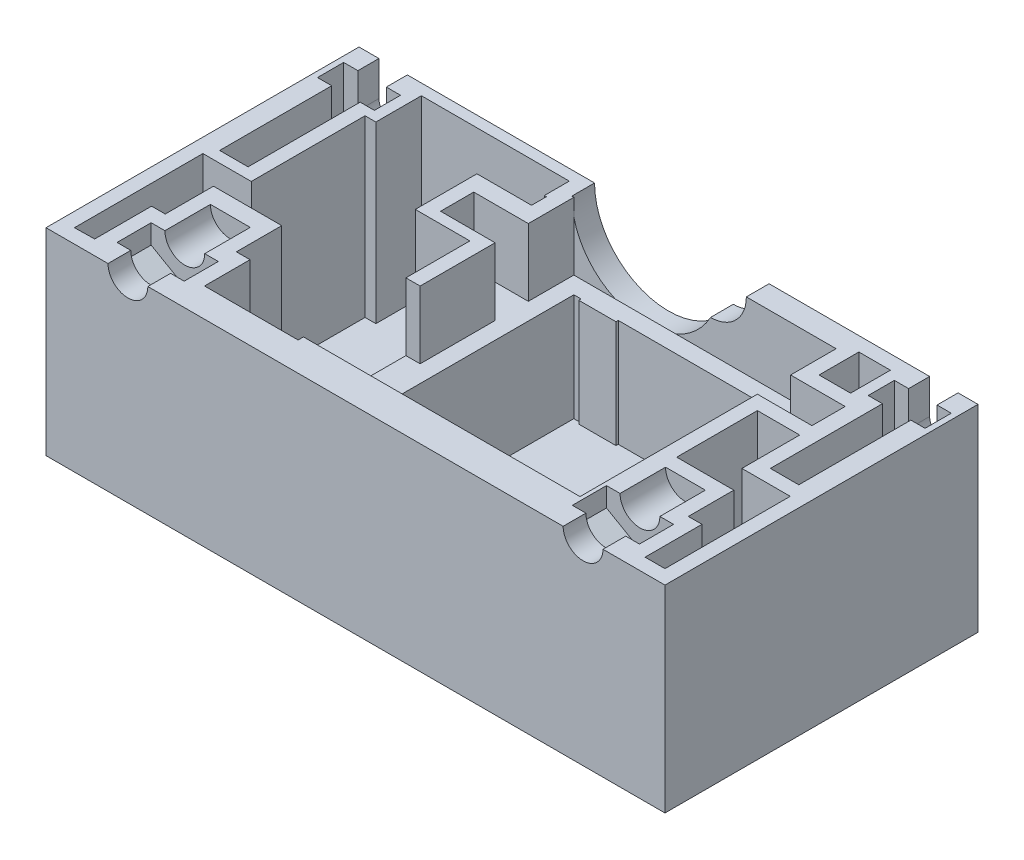
from build123d import *

# Parameters (mm, degrees)
SKETCH1_W           = 54.3999928
SKETCH1_H           = 27.5100034
BOSS_EXTRUDE1_DEPTH = 17.3500034
CUT_EXTRUDE1_DEPTH  = 15.3500074
CUT_EXTRUDE2_DEPTH  = 5.9200034
CUT_EXTRUDE3_DEPTH  = 9.430004
SKETCH5_W           = 4.795012
SKETCH5_H           = 2.9200094
CUT_EXTRUDE4_DEPTH  = 5.9200034
SKETCH6_W           = 2.769997
SKETCH6_H           = 3.499993
CUT_EXTRUDE5_DEPTH  = 15.3500074
CUT_EXTRUDE6_DEPTH  = 15.3500074
SKETCH8_R           = 1.7499965
CUT_EXTRUDE7_DEPTH  = 9.0000074
CUT_EXTRUDE8_DEPTH  = 13.9999974
SKETCH10_W          = 4.99999
SKETCH10_H          = 2.2999954
CUT_EXTRUDE9_DEPTH  = 4.320159
CUT_EXTRUDE10_DEPTH = 1.999996
CUT_EXTRUDE11_DEPTH = 2.999994
CUT_EXTRUDE12_DEPTH = 1.999996


with BuildPart() as part:
    # Sketch1 → Boss-Extrude1 (new body)
    with BuildSketch(Plane(origin=(0, 0, 0), x_dir=(1, 0, 0), z_dir=(0, 1, 0))):
        Rectangle(SKETCH1_W, SKETCH1_H)
    extrude(amount=BOSS_EXTRUDE1_DEPTH)

    # Sketch2 → Cut-Extrude1 (cut)
    with BuildSketch(Plane(origin=(0, 17.3500034, 0), x_dir=(1, 0, 0), z_dir=(0, 1, 0))):
        Polygon((-7.7499972, 12.7852805), (-20.7499966, 12.7852805), (-20.7499712, 8.7852885), (-21.699982, 8.7852885), (-21.699982, -1.2147169), (-25.9499862, -1.2147169), (-25.9499862, -12.5049915), (-24.199309728, -12.476075327), (-24.199309728, -7.476085327), (-22.999312128, -7.476085327), (-22.999312128, -3.2369379), (-16.999324128, -3.2369379), (-16.999324128, -7.2247379), (-15.799326528, -7.2247379), (-15.799326528, -11.2247299), (-7.569320128, -11.2247299), (-7.569320128, 3.8652831), (-12.364974, 3.8652831), (-12.364974, 9.2852875), (-7.5699874, 9.2852875), (-7.5699874, 10.5852849), (-7.7499972, 10.5852849), align=None)
    extrude(amount=-CUT_EXTRUDE1_DEPTH, mode=Mode.SUBTRACT)

    # Sketch3 → Cut-Extrude2 (cut)
    with BuildSketch(Plane(origin=(0, 17.3500034, 0), x_dir=(1, 0, 0), z_dir=(0, 1, 0))):
        Polygon((-7.5699874, -10.7550077), (-7.5699874, -1.7550003), (-6.3199772, -1.7550003), (-6.3199772, 11.7550057), (16.7300148, 11.7550057), (16.7300148, -10.7550077), align=None)
    extrude(amount=-CUT_EXTRUDE2_DEPTH, mode=Mode.SUBTRACT)

    # Sketch4 → Cut-Extrude3 (cut)
    with BuildSketch(Plane(origin=(0, 11.43, 0), x_dir=(1, 0, 0), z_dir=(0, 1, 0))):
        Polygon((15.2300178, 10.2550087), (15.2300178, -9.2549853), (-4.8199802, -9.2549853), (-4.8199802, 10.2550087), (-4.1839388, 10.2550087), (-4.1839388, 10.0550091), (-0.916671965, 10.0550091), (-0.916671965, 10.2550087), align=None)
    extrude(amount=-CUT_EXTRUDE3_DEPTH, mode=Mode.SUBTRACT)

    # Sketch5 → Cut-Extrude4 (cut)
    with BuildSketch(Plane(origin=(0, 17.3500034, 0), x_dir=(1, 0, 0), z_dir=(0, 1, 0))):
        with Locations((-8.7174832, 6.2949836)):
            Rectangle(SKETCH5_W, SKETCH5_H)
        with Locations((19.1275208, 6.2949836)):
            Rectangle(SKETCH5_W, SKETCH5_H)
    extrude(amount=-CUT_EXTRUDE4_DEPTH, mode=Mode.SUBTRACT)

    # Sketch6 → Cut-Extrude5 (cut)
    with BuildSketch(Plane(origin=(0, 17.3500034, 0), x_dir=(1, 0, 0), z_dir=(0, 1, 0))):
        with Locations((19.3649981, 10.754995)):
            Rectangle(SKETCH6_W, SKETCH6_H)
    extrude(amount=-CUT_EXTRUDE5_DEPTH, mode=Mode.SUBTRACT)

    # Sketch7 → Cut-Extrude6 (cut)
    with BuildSketch(Plane(origin=(0, 17.3500034, 0), x_dir=(1, 0, 0), z_dir=(0, 1, 0))):
        Polygon((21.7000074, 3.5849941), (17.9799996, 3.5849941), (17.9799996, -3.5050095), (23.0000048, -3.5050095), (23.0000048, -7.5050015), (24.2000024, -7.5050015), (24.2000024, -12.5049915), (25.9500116, -12.5049915), (25.9500116, -1.4949805), (21.7000074, -1.4949805), align=None)
    extrude(amount=-CUT_EXTRUDE6_DEPTH, mode=Mode.SUBTRACT)

    # Sketch8 → Cut-Extrude7 (cut)
    with BuildSketch(Plane.XY.offset(13.7550017)):
        with Locations((-19.9999981, 17.3500034)):
            Circle(SKETCH8_R)
        with Locations((19.9999981, 17.3500034)):
            Circle(SKETCH8_R)
    extrude(amount=-CUT_EXTRUDE7_DEPTH, mode=Mode.SUBTRACT)

    # Sketch9 → Cut-Extrude8 (cut)
    with BuildSketch(Plane(origin=(0, 0, -13.7550017), x_dir=(-1, 0, 0), z_dir=(0, 0, -1))):
        with BuildLine():
            Line((-25.4499872, 17.3500034), (-25.4499872, 14.2999968))
            ThreePointArc((-25.4499872, 14.2999968), (-24.1999897, 13.0499993), (-22.9499922, 14.2999968))
            Line((-22.9499922, 14.2999968), (-22.9499922, 17.3500034))
            Line((-22.9499922, 17.3500034), (-25.4499872, 17.3500034))
        make_face()
        with BuildLine():
            Line((22.9499922, 17.3500034), (25.4499872, 17.3500034))
            Line((25.4499872, 17.3500034), (25.4499872, 14.2999968))
            ThreePointArc((25.4499872, 14.2999968), (24.1999897, 13.0499993), (22.9499922, 14.2999968))
            Line((22.9499922, 14.2999968), (22.9499922, 17.3500034))
        make_face()
    extrude(amount=-CUT_EXTRUDE8_DEPTH, mode=Mode.SUBTRACT)

    # Sketch10 → Cut-Extrude9 (cut)
    with BuildSketch(Plane(origin=(0, 17.3500034, 0), x_dir=(1, 0, 0), z_dir=(0, 1, 0))):
        with Locations((-24.2000024, 10.754995)):
            Rectangle(SKETCH10_W, SKETCH10_H)
        with Locations((24.2000024, 10.754995)):
            Rectangle(SKETCH10_W, SKETCH10_H)
    extrude(amount=-CUT_EXTRUDE9_DEPTH, mode=Mode.SUBTRACT)

    # Sketch11 → Cut-Extrude10 (cut)
    with BuildSketch(Plane(origin=(0, 0, -11.7550057), x_dir=(-1, 0, 0), z_dir=(0, 0, -1))):
        Polygon((-26.399998, 13.0298444), (-24.2000024, 11.7596666), (-22.0000068, 13.0298444), align=None)
        Polygon((22.0000068, 13.0298444), (24.2000024, 11.7596666), (26.399998, 13.0298444), align=None)
    extrude(amount=-CUT_EXTRUDE10_DEPTH, mode=Mode.SUBTRACT)

    # Sketch13 → Cut-Extrude11 (cut)
    with BuildSketch(Plane.XY.offset(11.7550057)):
        Polygon((-22.9581964, 17.3500034), (-17.0581828, 17.3500034), (-17.0581828, 15.6468318), (-20.0081896, 13.9436602), (-22.9581964, 15.6468318), align=None)
        Polygon((17.0581828, 15.6468318), (20.0081896, 13.9436602), (22.9581964, 15.6468318), (22.9581964, 17.3500034), (17.0581828, 17.3500034), align=None)
    extrude(amount=-CUT_EXTRUDE11_DEPTH, mode=Mode.SUBTRACT)

    # Sketch14 → Cut-Extrude12 (cut)
    with BuildSketch(Plane(origin=(0, 0, -13.7550017), x_dir=(-1, 0, 0), z_dir=(0, 0, -1))):
        with BuildLine():
            Line((-6.499990556, 17.3500034), (-8.8399874, 17.3500034))
            ThreePointArc((-8.8399874, 17.3500034), (-7.917895682, 15.129395373), (-5.694061964, 14.215110549))
            ThreePointArc((-5.694061964, 14.215110549), (-6.295284996, 15.731587965), (-6.499990556, 17.3500034))
        make_face()
        with BuildLine():
            Line((-2.570163008, 17.3500034), (-6.499990556, 17.3500034))
            ThreePointArc((-6.499990556, 17.3500034), (-6.295284996, 15.731587965), (-5.694061964, 14.215110549))
            ThreePointArc((-5.694061964, 14.215110549), (-3.484467177, 15.137182922), (-2.570163008, 17.3500034))
        make_face()
        with BuildLine():
            ThreePointArc((-2.570163008, 17.3500034), (-3.484467177, 15.137182922), (-5.694061964, 14.215110549))
            ThreePointArc((-5.694061964, 14.215110549), (1.618426357, 11.054707482), (6.5000124, 17.3500034))
            Line((6.5000124, 17.3500034), (-2.570163008, 17.3500034))
        make_face()
    extrude(amount=-CUT_EXTRUDE12_DEPTH, mode=Mode.SUBTRACT)


solid = part.part
